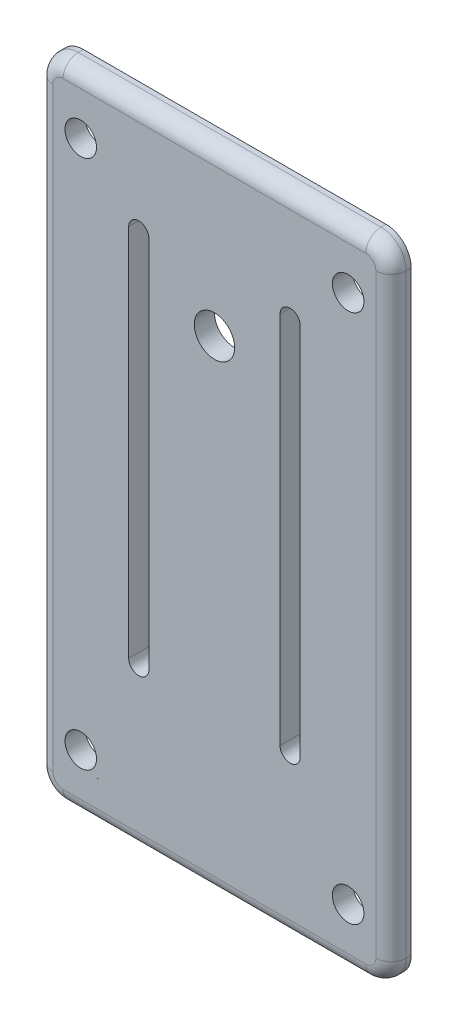
from build123d import *

# Parameters (mm, degrees)
SKETCH1_R           = 0.019660033
SKETCH1_R_2         = 1.5625
BOSS_EXTRUDE1_DEPTH = 2
FILLET1_R           = 1.5
SKETCH3_R           = 2
CUT_EXTRUDE2_DEPTH  = 37.527386986
CUT_EXTRUDE3_DEPTH  = 37.527386986


with BuildPart() as part:
    # Sketch1 → Boss-Extrude1 (new body)
    with BuildSketch(Plane.XY):
        with BuildLine():
            Line((-15, -32), (15, -32))
            ThreePointArc((15, -32), (16.767766953, -31.267766953), (17.5, -29.5))
            Line((17.5, -29.5), (17.5, 29.5))
            ThreePointArc((17.5, 29.5), (16.767766953, 31.267766953), (15, 32))
            Line((15, 32), (-15, 32))
            ThreePointArc((-15, 32), (-16.767766953, 31.267766953), (-17.5, 29.5))
            Line((-17.5, 29.5), (-17.5, -29.5))
            ThreePointArc((-17.5, -29.5), (-16.767766953, -31.267766953), (-15, -32))
        make_face()
        with Locations((-11.556302767, -27.879566704)):
            Circle(SKETCH1_R, mode=Mode.SUBTRACT)
        with Locations((-13.25, -26.25)):
            Circle(SKETCH1_R_2, mode=Mode.SUBTRACT)
        with Locations(Location((-13.25, 26.25, 0), (0, 0, 180))):
            Circle(SKETCH1_R_2, mode=Mode.SUBTRACT)
        with Locations(Location((13.25, -26.25, 0), (0, 0, 180))):
            Circle(SKETCH1_R_2, mode=Mode.SUBTRACT)
        with Locations((13.25, 26.25)):
            Circle(SKETCH1_R_2, mode=Mode.SUBTRACT)
    extrude(amount=BOSS_EXTRUDE1_DEPTH)

    # Fillet1
    fillet1_edges = [part.edges().sort_by_distance(p)[0] for p in [
        (16.767766953, -31.267766953, 2),
        (17.5, 0, 2),
        (16.767766953, 31.267766953, 2),
        (0, 32, 2),
        (-16.767766953, 31.267766953, 2),
        (-17.5, 0, 2),
        (-16.767766953, -31.267766953, 2),
        (0, -32, 2),
    ]]
    fillet(fillet1_edges, radius=FILLET1_R)

    # Sketch3 → Cut-Extrude2 (cut, through all)
    with BuildSketch(Plane.XY.offset(2)):
        with Locations((0, 15.9)):
            Circle(SKETCH3_R)
    extrude(amount=-CUT_EXTRUDE2_DEPTH, mode=Mode.SUBTRACT)

    # Sketch2 → Cut-Extrude3 (cut, through all)
    with BuildSketch(Plane.XY.offset(2)):
        with BuildLine():
            Line((-8.5, -16), (-8.5, 21.04))
            ThreePointArc((-8.5, 21.04), (-7.5, 22.04), (-6.5, 21.04))
            Line((-6.5, 21.04), (-6.5, -16))
            ThreePointArc((-6.5, -16), (-7.5, -17), (-8.5, -16))
        make_face()
        with BuildLine():
            Line((8.5, -16), (8.5, 21.04))
            ThreePointArc((8.5, 21.04), (7.5, 22.04), (6.5, 21.04))
            Line((6.5, 21.04), (6.5, -16))
            ThreePointArc((6.5, -16), (7.5, -17), (8.5, -16))
        make_face()
    extrude(amount=-CUT_EXTRUDE3_DEPTH, mode=Mode.SUBTRACT)


solid = part.part
